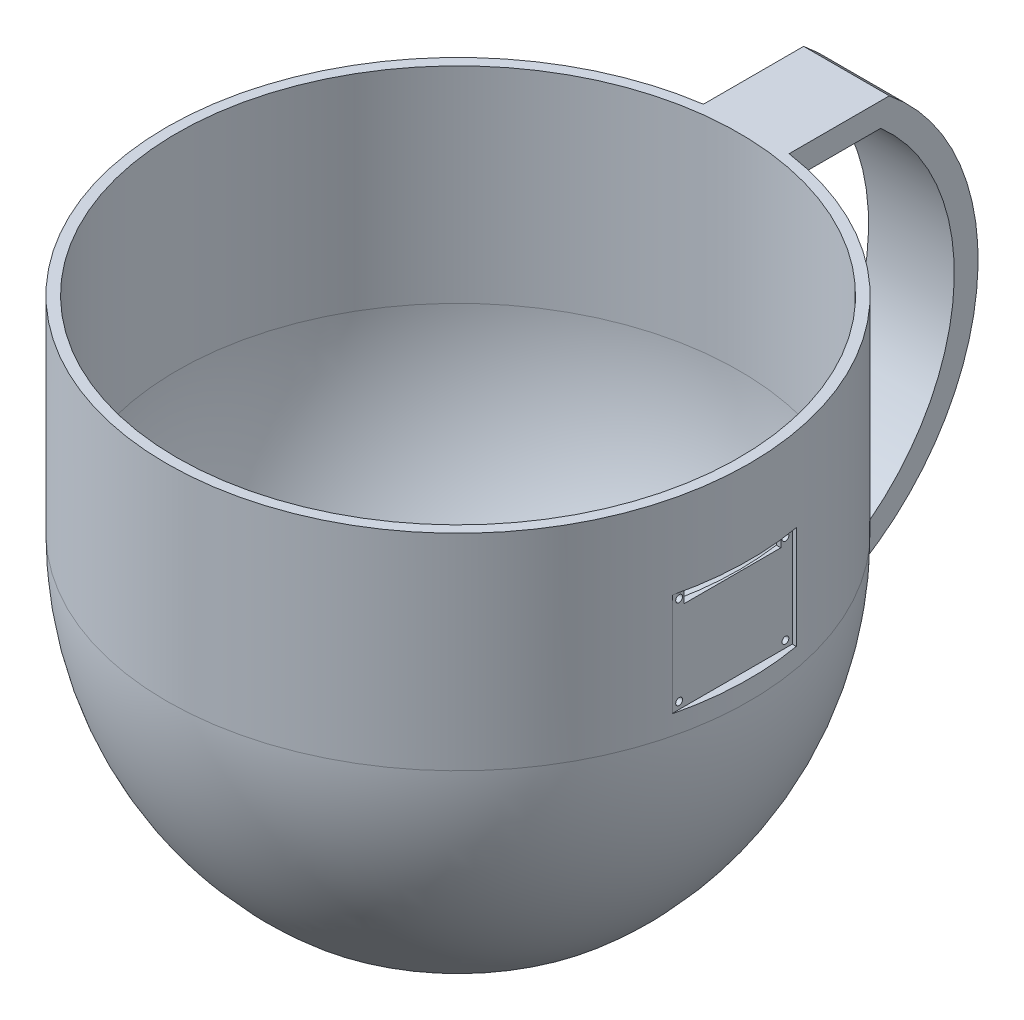
from build123d import *

# Parameters (mm, degrees)
CUT_EXTRUDE1_START  = 90
SKETCH5_W           = 35
SKETCH5_H           = 30
CUT_EXTRUDE1_DEPTH  = 7.5
SKETCH6_R           = 1
CUT_EXTRUDE2_DEPTH  = 200
SKETCH7_W           = 28.316069795
SKETCH7_H           = 4
CUT_EXTRUDE3_DEPTH  = 200
BOSS_EXTRUDE1_DEPTH = 12.5


with BuildPart() as part:
    # Sketch1 → Revolve1 (revolve)
    with BuildSketch(Plane.XY, mode=Mode.PRIVATE) as revolve1_sk:
        with BuildLine():
            Line((0, 0), (50, 0))
            ThreePointArc((50, 0), (75.829510623, 34.160419441), (85, 75.993420768))
            Line((85, 75.993420768), (85, 135.993420768))
            Line((85, 135.993420768), (82, 135.993420768))
            Line((82, 135.993420768), (82, 75.993420768))
            ThreePointArc((82, 75.993420768), (73.333437657, 35.915948395), (48.882396046, 3))
            Line((48.882396046, 3), (0, 3))
            Line((0, 3), (0, 0))
        make_face()
    revolve(revolve1_sk.sketch.rotate(Axis((0, 3, 0), (0, -1, 0)), 90), axis=Axis((0, 3, 0), (0, -1, 0)))

    # Sketch5 → Cut-Extrude1 (cut)
    with BuildSketch(Plane(origin=(0, 0, 0), x_dir=(0, 0, -1), z_dir=(1, 0, 0)).offset(CUT_EXTRUDE1_START)):
        with Locations((-2.5, 96.64173894)):
            Rectangle(SKETCH5_W, SKETCH5_H)
    extrude(amount=-CUT_EXTRUDE1_DEPTH, mode=Mode.SUBTRACT)

    # Sketch6 → Cut-Extrude2 (cut)
    with BuildSketch(Plane(origin=(0, 0, 0), x_dir=(0, 0, -1), z_dir=(1, 0, 0))):
        with Locations(Location((13, 109.64173894, 0), (0, 0, 180))):
            Circle(SKETCH6_R)
        with Locations(Location((-18, 109.64173894, 0), (0, 0, 180))):
            Circle(SKETCH6_R)
        with Locations(Location((-18, 83.64173894, 0), (0, 0, 180))):
            Circle(SKETCH6_R)
        with Locations(Location((13, 83.64173894, 0), (0, 0, 180))):
            Circle(SKETCH6_R)
    extrude(amount=CUT_EXTRUDE2_DEPTH, mode=Mode.SUBTRACT)

    # Sketch7 → Cut-Extrude3 (cut)
    with BuildSketch(Plane(origin=(0, 0, 0), x_dir=(0, 0, -1), z_dir=(1, 0, 0))):
        with Locations((-2.481965103, 109.64173894)):
            Rectangle(SKETCH7_W, SKETCH7_H)
    extrude(amount=CUT_EXTRUDE3_DEPTH, mode=Mode.SUBTRACT)

    # Sketch8 → Boss-Extrude1 (add, symmetric)
    with BuildSketch(Plane(origin=(0, 0, 0), x_dir=(0, 0, -1), z_dir=(1, 0, 0))):
        with BuildLine():
            Line((83.312879319, 135.993420768), (113.312879319, 135.993420768))
            ThreePointArc((113.312879319, 135.993420768), (133.385711701, 53.763756217), (59.530866873, 12.410422282))
            Line((59.530866873, 12.410422282), (64.835382952, 18.828532511))
            ThreePointArc((64.835382952, 18.828532511), (127.404142813, 57.435015297), (110.778554033, 129.051354364))
            Line((110.778554033, 129.051354364), (83.312879319, 129.051354364))
            Line((83.312879319, 129.051354364), (83.312879319, 135.993420768))
        make_face()
    extrude(amount=BOSS_EXTRUDE1_DEPTH, both=True)


solid = part.part
